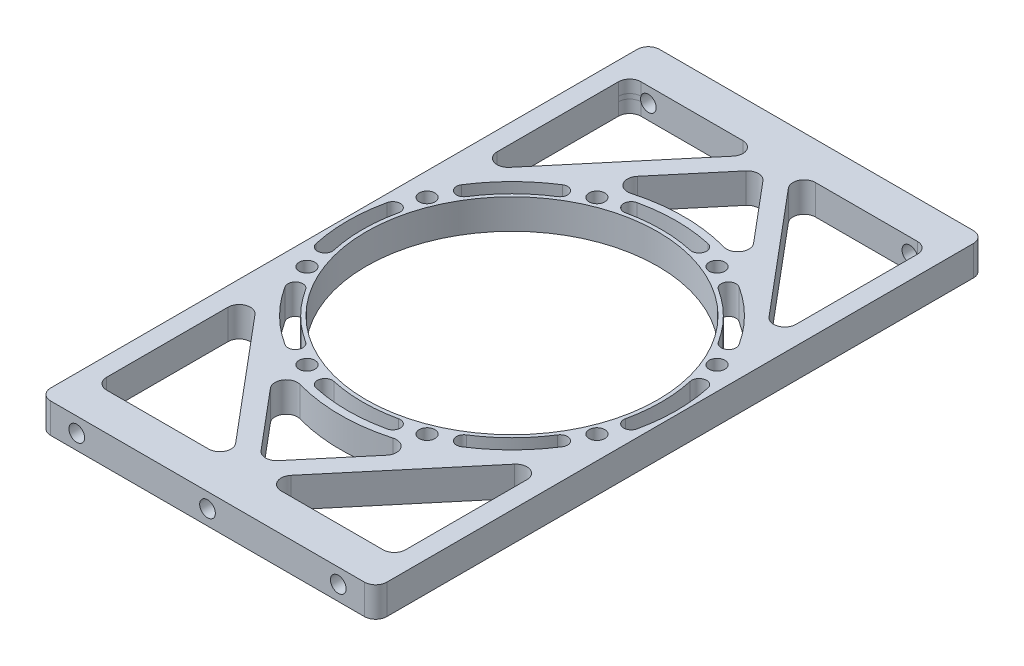
from build123d import *

# Parameters (mm, degrees)
SKETCH_1_W                  = 90
SKETCH_1_H                  = 163
SKETCH_1_R                  = 39
EXTRUDE_1_DEPTH             = 4
SKETCH_2_R                  = 1.9
CUT_EXTRUDE_1_DEPTH         = 94.441157955
PATTERN_CIRCULAR_1_COUNT    = 8
HOLE_WIZARD_M4_2_D          = 4.2
SKETCH_12_R                 = 2.1
CUT_EXTRUDE_2_DEPTH         = 5
HOLE_WIZARD_M5_1_AT_2_COUNT = 2
HOLE_WIZARD_M5_1_AT_2_PITCH = 35
HOLE_WIZARD_M5_1_AT_3_COUNT = 2
HOLE_WIZARD_M5_1_AT_3_PITCH = 35
CUT_EXTRUDE_3_DEPTH         = 10
FILLET_1_R                  = 3
FILLET_2_R                  = 3
CUT_EXTRUDE_4_DEPTH         = 94.441157964


with BuildPart() as part:
    # 草图1 → 凸台-拉伸1 (new, symmetric)
    with BuildSketch(Plane(origin=(0, 0, 0), x_dir=(1, 0, 0), z_dir=(0, 1, 0))):
        Rectangle(SKETCH_1_W, SKETCH_1_H)
        with Locations(Location((0, 0, 0), (0, 0, 270))):
            Circle(SKETCH_1_R, mode=Mode.SUBTRACT)
    extrude(amount=EXTRUDE_1_DEPTH, both=True)

    # 草图2 → 切除-拉伸1 (cut, through all)
    with BuildSketch(Plane(origin=(0, 4, 0), x_dir=(1, 0, 0), z_dir=(0, 1, 0))):
        with Locations(Location((-16.072704159, 38.802940365, 0), (0, 0, 270))):
            Circle(SKETCH_2_R)
    cut_extrude_1 = extrude(amount=-CUT_EXTRUDE_1_DEPTH, mode=Mode.SUBTRACT)

    # 阵列(圆周)1: 切除-拉伸1 ×8 about axis
    pattern_circular_1_axis = Axis((0, 0, 0), (0, 1, 0))
    for i in range(1, PATTERN_CIRCULAR_1_COUNT):
        add(cut_extrude_1.rotate(pattern_circular_1_axis, i * 360 / PATTERN_CIRCULAR_1_COUNT), mode=Mode.SUBTRACT)

    # M4 螺纹孔2 (through all)
    with Locations(Plane(origin=(16.072704159, 4, -38.802940365), x_dir=(0, 0, 1), z_dir=(0, 1, 0))):
        with Locations((0, 0), (22.730236206, 22.730236206), (54.875644524, 22.730236206), (77.60588073, 0), (77.60588073, -32.145408318), (54.875644524, -54.875644524), (22.730236206, -54.875644524), (0, -32.145408318)):
            Hole(HOLE_WIZARD_M4_2_D / 2)

    # 草图12 → 切除-拉伸2 (cut)
    with BuildSketch(Plane.XY.offset(81.5)):
        Circle(SKETCH_12_R)
        with Locations((35, 0)):
            Circle(SKETCH_12_R)
        with Locations((-35, 0)):
            Circle(SKETCH_12_R)
    cut_extrude_2 = extrude(amount=-CUT_EXTRUDE_2_DEPTH, mode=Mode.SUBTRACT)

    # 草图14 → M5 螺纹孔1 (revolve, cut)
    with BuildSketch(Plane(origin=(0, 0, 81.5), x_dir=(0, -1, 0), z_dir=(1, 0, 0))):
        Polygon((0, 0), (0, 11.2618073), (2.1, 10), (2.1, 0), align=None)
    hole_wizard_m5_1 = revolve(axis=Axis((0, 0, 87.85), (0, 0, -1)), mode=Mode.SUBTRACT)

    # M5 螺纹孔1 at 2: M5 螺纹孔1 ×2
    with Locations(*[(i * HOLE_WIZARD_M5_1_AT_2_PITCH, 0, 0) for i in range(1, HOLE_WIZARD_M5_1_AT_2_COUNT)]):
        add(hole_wizard_m5_1, mode=Mode.SUBTRACT)

    # M5 螺纹孔1 at 3: M5 螺纹孔1 ×2
    with Locations(*[(-i * HOLE_WIZARD_M5_1_AT_3_PITCH, 0, 0) for i in range(1, HOLE_WIZARD_M5_1_AT_3_COUNT)]):
        add(hole_wizard_m5_1, mode=Mode.SUBTRACT)

    # 镜向1: 切除-拉伸2, M5 螺纹孔1 across plane
    add(cut_extrude_2.mirror(Plane.XY), mode=Mode.SUBTRACT)
    add(hole_wizard_m5_1.mirror(Plane.XY), mode=Mode.SUBTRACT)

    # 镜向1 copy 1 sketch → 镜向1 copy 1 (revolve, cut)
    with BuildSketch(Plane(origin=(35, 0, -81.5), x_dir=(0, -1, 0), z_dir=(1, 0, 0))):
        Polygon((0, 0), (0, -11.2618073), (2.1, -10), (2.1, 0), align=None)
    revolve(axis=Axis((35, 0, -87.85), (0, 0, -1)), mode=Mode.SUBTRACT)

    # 镜向1 copy 2 sketch → 镜向1 copy 2 (revolve, cut)
    with BuildSketch(Plane(origin=(-35, 0, -81.5), x_dir=(0, -1, 0), z_dir=(1, 0, 0))):
        Polygon((0, 0), (0, -11.2618073), (2.1, -10), (2.1, 0), align=None)
    revolve(axis=Axis((-35, 0, -87.85), (0, 0, -1)), mode=Mode.SUBTRACT)

    # 草图15 → 切除-拉伸3 (cut)
    with BuildSketch(Plane(origin=(0, 4, 0), x_dir=(1, 0, 0), z_dir=(0, 1, 0))):
        with BuildLine():
            Line((0, 67.614130435), (-23.678641607, 39.437570052))
            ThreePointArc((-23.678641607, 39.437570052), (0, 46), (23.678641607, 39.437570052))
            Line((23.678641607, 39.437570052), (0, 67.614130435))
        make_face()
        Polygon((40, 27.787597925), (40, 71.5), (3.265555182, 71.5), align=None)
        Polygon((-40, 27.787597925), (-3.265555182, 71.5), (-40, 71.5), align=None)
    cut_extrude_3 = extrude(amount=-CUT_EXTRUDE_3_DEPTH, mode=Mode.SUBTRACT)

    # 镜向2: 切除-拉伸3 across plane
    add(cut_extrude_3.mirror(Plane.XY), mode=Mode.SUBTRACT)

    # 圆角1
    fillet_1_edges = [part.edges().sort_by_distance(p)[0] for p in [
        (-3.265555182, 0, -71.5),
        (-40, 0, -27.787597925),
        (-40, 0, -71.5),
        (40, 0, -71.5),
        (40, 0, -27.787597925),
        (3.265555182, 0, -71.5),
        (23.678641607, 0, -39.437570052),
        (-23.678641607, 0, -39.437570052),
        (0, 0, -67.614130435),
        (-40, 0, 27.787597925),
        (-40, 0, 71.5),
        (-3.265555182, 0, 71.5),
        (3.265555182, 0, 71.5),
        (40, 0, 27.787597925),
        (40, 0, 71.5),
        (-23.678641607, 0, 39.437570052),
        (23.678641607, 0, 39.437570052),
        (0, 0, 67.614130435),
    ]]
    fillet(fillet_1_edges, radius=FILLET_1_R)

    # 圆角2
    fillet_2_edges = [part.edges().sort_by_distance(p)[0] for p in [
        (45, 0, 81.5),
        (-45, 0, 81.5),
        (-45, 0, -81.5),
        (45, 0, -81.5),
    ]]
    fillet(fillet_2_edges, radius=FILLET_2_R)

    # 草图16 → 切除-拉伸4 (cut, through all)
    with BuildSketch(Plane(origin=(0, 4, 0), x_dir=(1, 0, 0), z_dir=(0, 1, 0))):
        with BuildLine():
            ThreePointArc((9.523343013, 42.957024313), (0, 44), (-9.523343013, 42.957024313))
            ThreePointArc((-9.523343013, 42.957024313), (-11.0430558, 40.571553071), (-8.657584558, 39.051840285))
            ThreePointArc((-8.657584558, 39.051840285), (0, 40), (8.657584558, 39.051840285))
            ThreePointArc((8.657584558, 39.051840285), (11.0430558, 40.571553071), (9.523343013, 42.957024313))
        make_face()
        with BuildLine():
            ThreePointArc((37.109223616, 23.641182767), (31.112698372, 31.112698372), (23.641182767, 37.109223616))
            ThreePointArc((23.641182767, 37.109223616), (20.879800659, 36.497039941), (21.491984334, 33.735657833))
            ThreePointArc((21.491984334, 33.735657833), (28.284271247, 28.284271247), (33.735657833, 21.491984334))
            ThreePointArc((33.735657833, 21.491984334), (36.497039941, 20.879800659), (37.109223616, 23.641182767))
        make_face()
        with BuildLine():
            ThreePointArc((42.957024313, -9.523343013), (44, 0), (42.957024313, 9.523343013))
            ThreePointArc((42.957024313, 9.523343013), (40.571553071, 11.0430558), (39.051840285, 8.657584558))
            ThreePointArc((39.051840285, 8.657584558), (40, 0), (39.051840285, -8.657584558))
            ThreePointArc((39.051840285, -8.657584558), (40.571553071, -11.0430558), (42.957024313, -9.523343013))
        make_face()
        with BuildLine():
            ThreePointArc((23.641182767, -37.109223616), (31.112698372, -31.112698372), (37.109223616, -23.641182767))
            ThreePointArc((37.109223616, -23.641182767), (36.497039941, -20.879800659), (33.735657833, -21.491984334))
            ThreePointArc((33.735657833, -21.491984334), (28.284271247, -28.284271247), (21.491984334, -33.735657833))
            ThreePointArc((21.491984334, -33.735657833), (20.879800659, -36.497039941), (23.641182767, -37.109223616))
        make_face()
        with BuildLine():
            ThreePointArc((-9.523343013, -42.957024313), (0, -44), (9.523343013, -42.957024313))
            ThreePointArc((9.523343013, -42.957024313), (11.0430558, -40.571553071), (8.657584558, -39.051840285))
            ThreePointArc((8.657584558, -39.051840285), (0, -40), (-8.657584558, -39.051840285))
            ThreePointArc((-8.657584558, -39.051840285), (-11.0430558, -40.571553071), (-9.523343013, -42.957024313))
        make_face()
        with BuildLine():
            ThreePointArc((-37.109223616, -23.641182767), (-31.112698372, -31.112698372), (-23.641182767, -37.109223616))
            ThreePointArc((-23.641182767, -37.109223616), (-20.879800659, -36.497039941), (-21.491984334, -33.735657833))
            ThreePointArc((-21.491984334, -33.735657833), (-28.284271247, -28.284271247), (-33.735657833, -21.491984334))
            ThreePointArc((-33.735657833, -21.491984334), (-36.497039941, -20.879800659), (-37.109223616, -23.641182767))
        make_face()
        with BuildLine():
            ThreePointArc((-42.957024313, 9.523343013), (-44, 0), (-42.957024313, -9.523343013))
            ThreePointArc((-42.957024313, -9.523343013), (-40.571553071, -11.0430558), (-39.051840285, -8.657584558))
            ThreePointArc((-39.051840285, -8.657584558), (-40, 0), (-39.051840285, 8.657584558))
            ThreePointArc((-39.051840285, 8.657584558), (-40.571553071, 11.0430558), (-42.957024313, 9.523343013))
        make_face()
        with BuildLine():
            ThreePointArc((-23.641182767, 37.109223616), (-31.112698372, 31.112698372), (-37.109223616, 23.641182767))
            ThreePointArc((-37.109223616, 23.641182767), (-36.497039941, 20.879800659), (-33.735657833, 21.491984334))
            ThreePointArc((-33.735657833, 21.491984334), (-28.284271247, 28.284271247), (-21.491984334, 33.735657833))
            ThreePointArc((-21.491984334, 33.735657833), (-20.879800659, 36.497039941), (-23.641182767, 37.109223616))
        make_face()
    extrude(amount=-CUT_EXTRUDE_4_DEPTH, mode=Mode.SUBTRACT)


solid = part.part
